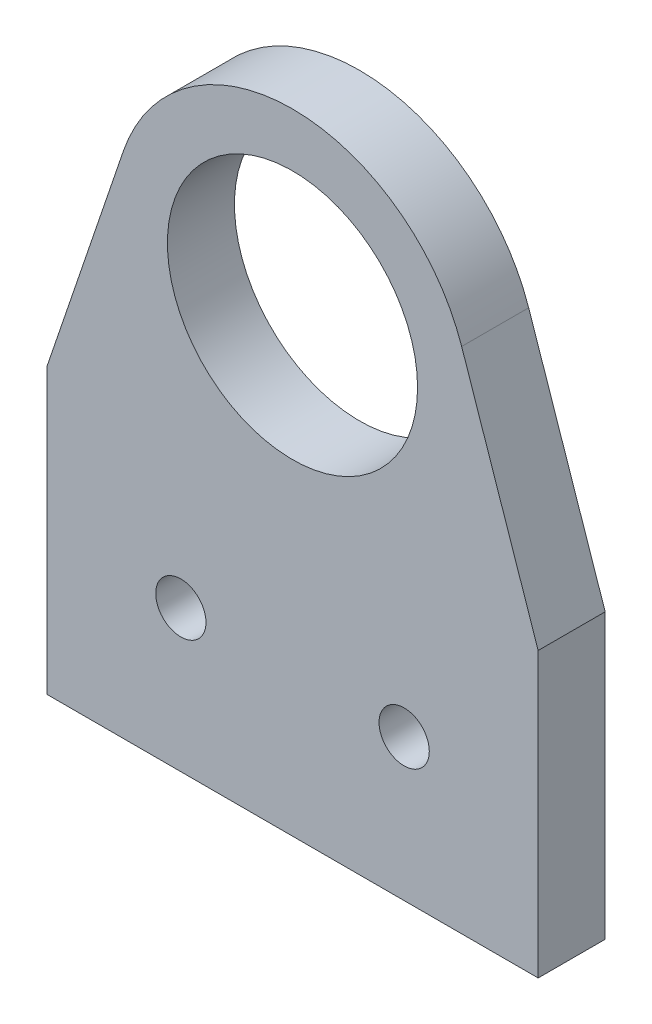
from build123d import *

# Parameters (mm, degrees)
SKETCH1_R            = 11.2
SKETCH1_W            = 44
SKETCH1_H            = 25.4
BOSS_EXTRUDE1_DEPTH  = 6
M4_CLEARANCE_HOLE1_D = 4.5


with BuildPart() as part:
    # Sketch1 → Boss-Extrude1 (new body)
    # profile 1 of 2: a face of its own
    with BuildSketch(Plane.XY):
        with BuildLine():
            ThreePointArc((-15.148252746, 5.150770694), (0, 16), (15.148252746, 5.150770694))
            Line((15.148252746, 5.150770694), (22, -15))
            Line((22, -15), (-22, -15))
            Line((-22, -15), (-15.148252746, 5.150770694))
        make_face()
        Circle(SKETCH1_R, mode=Mode.SUBTRACT)
    # profile 2 of 2: a face of its own
    with BuildSketch(Plane.XY):
        with Locations((0, -27.7)):
            Rectangle(SKETCH1_W, SKETCH1_H)
    extrude(amount=BOSS_EXTRUDE1_DEPTH)

    # M4 Clearance Hole1 (through all)
    with Locations(Plane.XY.offset(6)):
        with Locations((-10, -27.7), (10, -27.7)):
            Hole(M4_CLEARANCE_HOLE1_D / 2)


solid = part.part
